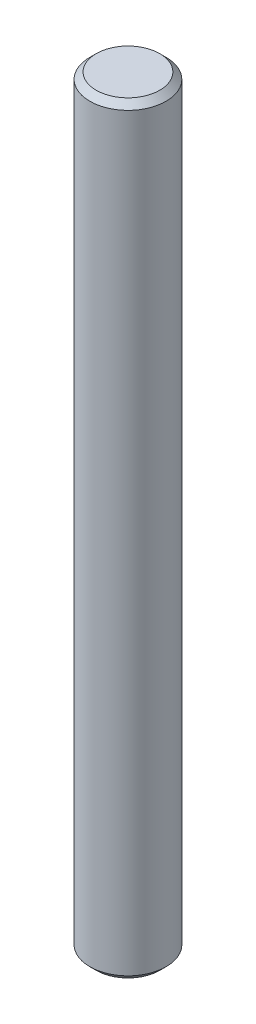
from build123d import *

# Parameters (mm, degrees)
SKETCH2_R           = 1.5
BOSS_EXTRUDE1_DEPTH = 30
CHAMFER1_SIZE       = 0.25


with BuildPart() as part:
    # Sketch2 → Boss-Extrude1 (new body)
    with BuildSketch(Plane(origin=(0, 0, 0), x_dir=(1, 0, 0), z_dir=(0, 1, 0))):
        with Locations(Location((0, 0, 0), (0, 0, 270))):
            Circle(SKETCH2_R)
    extrude(amount=BOSS_EXTRUDE1_DEPTH)

    # Chamfer1
    chamfer1_edges = [part.edges().sort_by_distance(p)[0] for p in [
        (0, 0, -1.5),
        (0, 30, -1.5),
    ]]
    chamfer(chamfer1_edges, length=CHAMFER1_SIZE)


solid = part.part
